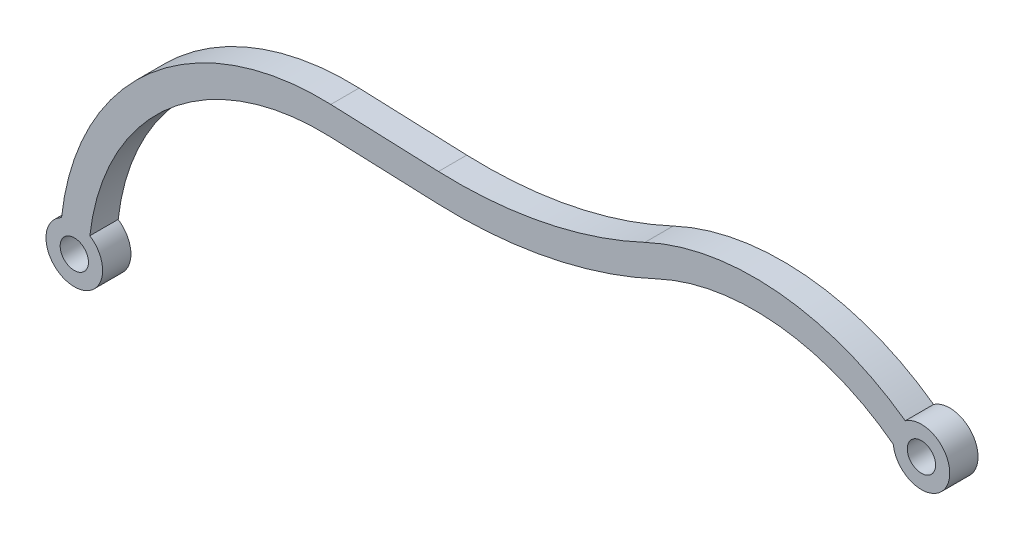
from build123d import *

# Parameters (mm, degrees)
SKETCH1_R           = 1.5
BOSS_EXTRUDE1_DEPTH = 3


with BuildPart() as part:
    # Sketch1 → Boss-Extrude1 (new body)
    with BuildSketch(Plane.XY):
        with BuildLine():
            ThreePointArc((-105.112423116, -13.831138676), (-96.691314892, 2.069847591), (-79.69956033, 7.989028691))
            Line((-79.69956033, 7.989028691), (-68.289776062, 7.543112506))
            ThreePointArc((-68.289776062, 7.543112506), (-56.37401605, 8.503345495), (-45.024076574, 12.256511885))
            ThreePointArc((-45.024076574, 12.256511885), (-32.132147942, 14.423979547), (-19.981968964, 9.599781095))
            ThreePointArc((-19.981968964, 9.599781095), (-14.269337445, 8.685833715), (-18.71157232, 12.392045797))
            ThreePointArc((-18.71157232, 12.392045797), (-32.153587478, 17.440965919), (-46.2987226, 14.9722581))
            ThreePointArc((-46.2987226, 14.9722581), (-56.969685192, 11.443613896), (-68.172619764, 10.540824034))
            Line((-68.172619764, 10.540824034), (-79.582404032, 10.986740218))
            ThreePointArc((-79.582404032, 10.986740218), (-98.709612397, 4.290845071), (-108.111857285, -13.661394421))
            ThreePointArc((-108.111857285, -13.661394421), (-106.928371833, -19.334178574), (-105.112423116, -13.831138676))
        make_face()
        with Locations((-106.758866773, -16.338971063)):
            Circle(SKETCH1_R, mode=Mode.SUBTRACT)
        with Locations((-17, 9.92820323)):
            Circle(SKETCH1_R, mode=Mode.SUBTRACT)
    extrude(amount=BOSS_EXTRUDE1_DEPTH)


solid = part.part
